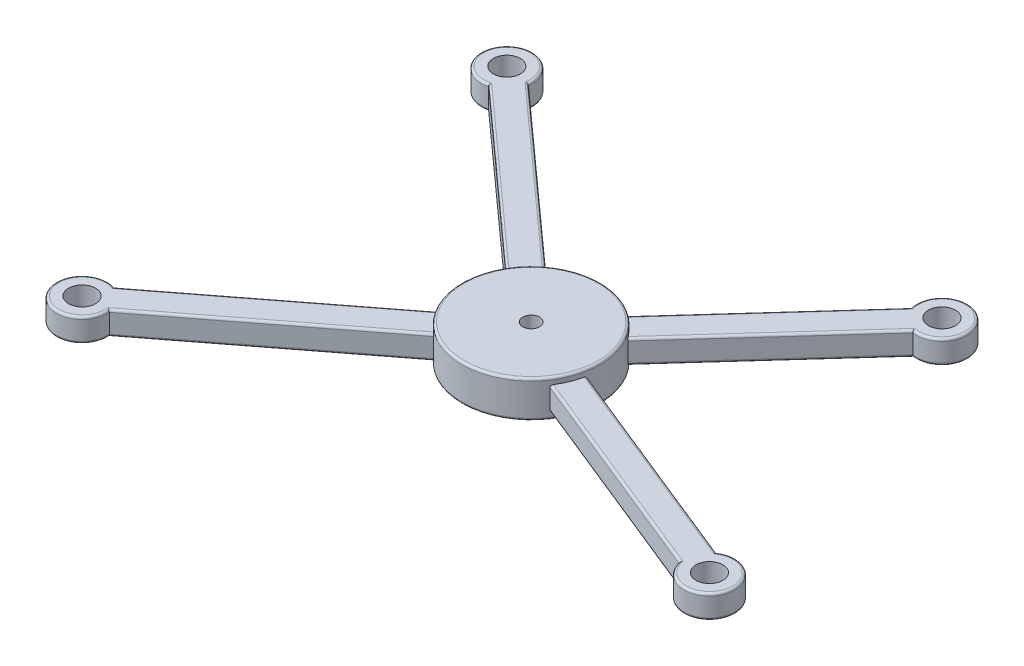
from build123d import *

# Parameters (mm, degrees)
SKETCH2_R           = 15
BOSS_EXTRUDE1_DEPTH = 4
BOSS_EXTRUDE2_DEPTH = 2.555
FILLET1_R           = 0.5
CUT_EXTRUDE1_REACH  = 90.087
SKETCH3_R           = 1.825
CUT_EXTRUDE2_REACH  = 89.967
SKETCH4_R           = 2.925


with BuildPart() as part:
    # Sketch2 → Boss-Extrude1 (new, symmetric)
    with BuildSketch(Plane(origin=(0, 0, 0), x_dir=(1, 0, 0), z_dir=(0, 1, 0))):
        with Locations(Location((0, 0, 0), (0, 0, 270))):
            Circle(SKETCH2_R)
    extrude(amount=BOSS_EXTRUDE1_DEPTH, both=True)

    # Sketch1 → Boss-Extrude2 (add, symmetric)
    with BuildSketch(Plane(origin=(0, 0, 0), x_dir=(1, 0, 0), z_dir=(0, 1, 0))):
        with BuildLine():
            Line((-46.594066944, 45.994431578), (-0.221936811, 4.313892269))
            Line((-0.221936811, 4.313892269), (36.929612054, 45.344257029))
            ThreePointArc((36.929612054, 45.344257029), (45.993963511, 50.795973714), (41.466224373, 41.236514501))
            Line((41.466224373, 41.236514501), (5.2084811, 1.193273309))
            Line((5.2084811, 1.193273309), (61.771620581, -21.697043607))
            ThreePointArc((61.771620581, -21.697043607), (70.009503371, -28.331873619), (59.475810365, -27.370107634))
            Line((59.475810365, -27.370107634), (0.477396998, -3.494269201))
            Line((0.477396998, -3.494269201), (-49.455246799, -41.936458505))
            ThreePointArc((-49.455246799, -41.936458505), (-59.344922838, -45.688523268), (-53.188657072, -37.087123733))
            Line((-53.188657072, -37.087123733), (-4.779875288, 0.181873295))
            Line((-4.779875288, 0.181873295), (-50.685181399, 41.442818401))
            ThreePointArc((-50.685181399, 41.442818401), (-56.170030256, 50.487160011), (-46.594066944, 45.994431578))
        make_face()
    extrude(amount=BOSS_EXTRUDE2_DEPTH, both=True)

    # Fillet1
    fillet1_edges = [part.edges().sort_by_distance(p)[0] for p in [
        (0, 4, -15),
        (-29.612110989, 2.555, 26.659607028),
        (-33.345521263, 2.555, 21.810272256),
        (-59.344922838, 2.555, 45.688523268),
        (-31.82602715, 2.555, -24.491694574),
        (-27.734912694, 2.555, -29.04330775),
        (-56.170030256, 2.555, -50.487160011),
        (22.258790632, 2.555, -29.141725165),
        (26.795402951, 2.555, -25.033982637),
        (45.993963511, 2.555, -50.795973714),
        (45.993963511, -2.555, -50.795973714),
        (22.258790632, -2.555, -29.141725165),
        (-27.734912694, -2.555, -29.04330775),
        (-56.170030256, -2.555, -50.487160011),
        (-31.82602715, -2.555, -24.491694574),
        (-33.345521263, -2.555, 21.810272256),
        (-59.344922838, -2.555, 45.688523268),
        (-29.612110989, -2.555, 26.659607028),
        (35.970036611, -2.555, 17.857647478),
        (70.009503371, -2.555, 28.331873619),
        (38.265846827, -2.555, 12.184583452),
        (26.795402951, -2.555, -25.033982637),
        (38.265846827, 2.555, 12.184583452),
        (35.970036611, 2.555, 17.857647478),
        (70.009503371, 2.555, 28.331873619),
        (0, -4, -15),
    ]]
    fillet(fillet1_edges, radius=FILLET1_R)

    # Sketch3 → Cut-Extrude1 (cut, up to next)
    with BuildSketch(Plane(origin=(0, 4, 0), x_dir=(1, 0, 0), z_dir=(0, 1, 0)), mode=Mode.PRIVATE) as cut_extrude1_sk1:
        with Locations(Location((0, 0, 0), (0, 0, 270))):
            Circle(SKETCH3_R)
    cut_extrude1_tool1 = extrude(cut_extrude1_sk1.sketch, amount=-CUT_EXTRUDE1_REACH, mode=Mode.PRIVATE) & part.part
    add(cut_extrude1_tool1.solids().sort_by_distance((0, 4, 0))[0], mode=Mode.SUBTRACT)

    # Sketch4 → Cut-Extrude2 (cut, up to next)
    with BuildSketch(Plane(origin=(0, 2.555, 0), x_dir=(1, 0, 0), z_dir=(0, 1, 0)), mode=Mode.PRIVATE) as cut_extrude2_sk1:
        with Locations(Location((-52.060935027, 46.793792794, 0), (0, 0, 270))):
            Circle(SKETCH4_R)
    cut_extrude2_tool1 = extrude(cut_extrude2_sk1.sketch, amount=-CUT_EXTRUDE2_REACH, mode=Mode.PRIVATE) & part.part
    # Sketch4 → Cut-Extrude2 (cut, up to next)
    with BuildSketch(Plane(origin=(0, 2.555, 0), x_dir=(1, 0, 0), z_dir=(0, 1, 0)), mode=Mode.PRIVATE) as cut_extrude2_sk2:
        with Locations(Location((42.28558484, 46.700420927, 0), (0, 0, 270))):
            Circle(SKETCH4_R)
    cut_extrude2_tool2 = extrude(cut_extrude2_sk2.sketch, amount=-CUT_EXTRUDE2_REACH, mode=Mode.PRIVATE) & part.part
    # Sketch4 → Cut-Extrude2 (cut, up to next)
    with BuildSketch(Plane(origin=(0, 2.555, 0), x_dir=(1, 0, 0), z_dir=(0, 1, 0)), mode=Mode.PRIVATE) as cut_extrude2_sk3:
        with Locations(Location((64.887987235, -26.259267174, 0), (0, 0, 270))):
            Circle(SKETCH4_R)
    cut_extrude2_tool3 = extrude(cut_extrude2_sk3.sketch, amount=-CUT_EXTRUDE2_REACH, mode=Mode.PRIVATE) & part.part
    # Sketch4 → Cut-Extrude2 (cut, up to next)
    with BuildSketch(Plane(origin=(0, 2.555, 0), x_dir=(1, 0, 0), z_dir=(0, 1, 0)), mode=Mode.PRIVATE) as cut_extrude2_sk4:
        with Locations(Location((-54.967051168, -42.318083438, 0), (0, 0, 270))):
            Circle(SKETCH4_R)
    cut_extrude2_tool4 = extrude(cut_extrude2_sk4.sketch, amount=-CUT_EXTRUDE2_REACH, mode=Mode.PRIVATE) & part.part
    add(cut_extrude2_tool1.solids().sort_by_distance((-52.060935, 2.555, -46.793793))[0], mode=Mode.SUBTRACT)
    add(cut_extrude2_tool2.solids().sort_by_distance((42.285585, 2.555, -46.700421))[0], mode=Mode.SUBTRACT)
    add(cut_extrude2_tool3.solids().sort_by_distance((64.887987, 2.555, 26.259267))[0], mode=Mode.SUBTRACT)
    add(cut_extrude2_tool4.solids().sort_by_distance((-54.967051, 2.555, 42.318083))[0], mode=Mode.SUBTRACT)


solid = part.part
